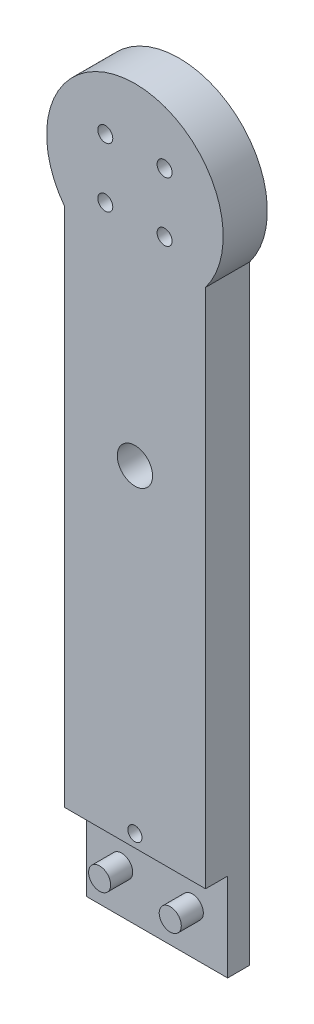
from build123d import *

# Parameters (mm, degrees)
BOSS_EXTRU_1_DEPTH      = 10
ESQUISSE3_W             = 32
ESQUISSE3_H             = 5
BOSS_EXTRU_2_DEPTH      = 20
ESQUISSE4_R             = 2.5
BOSS_EXTRU_3_DEPTH      = 5
ESQUISSE6_R             = 1.7
ESQUISSE6_R_2           = 4
ESQUISSE6_R_3           = 1.6
ENL_V_MAT_EXTRU_1_DEPTH = 152.657508881


with BuildPart() as part:
    # Esquisse1 → Boss.-Extru.1 (new body)
    with BuildSketch(Plane.XY):
        with BuildLine():
            ThreePointArc((-16, 118), (0, 110), (16, 118))
            Line((16, 118), (16, 130))
            Line((16, 130), (-16, 130))
            Line((-16, 130), (-16, 118))
        make_face()
        with BuildLine():
            Line((16, 130), (16, 118))
            ThreePointArc((16, 118), (18.973665961, 123.67544468), (20, 130))
            ThreePointArc((20, 130), (-6.32455532, 148.973665961), (-16, 118))
            Line((-16, 118), (-16, 130))
            Line((-16, 130), (16, 130))
        make_face()
        with BuildLine():
            Line((-16, 0), (16, 0))
            Line((16, 0), (16, 118))
            ThreePointArc((16, 118), (0, 110), (-16, 118))
            Line((-16, 118), (-16, 0))
        make_face()
    extrude(amount=BOSS_EXTRU_1_DEPTH)

    # Esquisse3 → Boss.-Extru.2 (add)
    with BuildSketch(Plane.XZ):
        with Locations((0, 2.5)):
            Rectangle(ESQUISSE3_W, ESQUISSE3_H)
    extrude(amount=BOSS_EXTRU_2_DEPTH)

    # Esquisse4 → Boss.-Extru.3 (add)
    with BuildSketch(Plane.XY.offset(5)):
        with Locations(Location((-8, -10, 0), (0, 0, 180))):
            Circle(ESQUISSE4_R)
        with Locations(Location((8, -10, 0), (0, 0, 180))):
            Circle(ESQUISSE4_R)
    extrude(amount=BOSS_EXTRU_3_DEPTH)

    # Esquisse6 → Enlèv. mat.-Extru.1 (cut, through all)
    with BuildSketch(Plane.XY.offset(10)):
        with Locations((-6.717514421, 136.717514421)):
            Circle(ESQUISSE6_R)
        with Locations((6.717514421, 136.717514421)):
            Circle(ESQUISSE6_R)
        with Locations((6.717514421, 123.282485579)):
            Circle(ESQUISSE6_R)
        with Locations((-6.717514421, 123.282485579)):
            Circle(ESQUISSE6_R)
        with Locations((0, 75)):
            Circle(ESQUISSE6_R_2)
        with Locations((0, 2.83)):
            Circle(ESQUISSE6_R_3)
    extrude(amount=-ENL_V_MAT_EXTRU_1_DEPTH, mode=Mode.SUBTRACT)


solid = part.part
